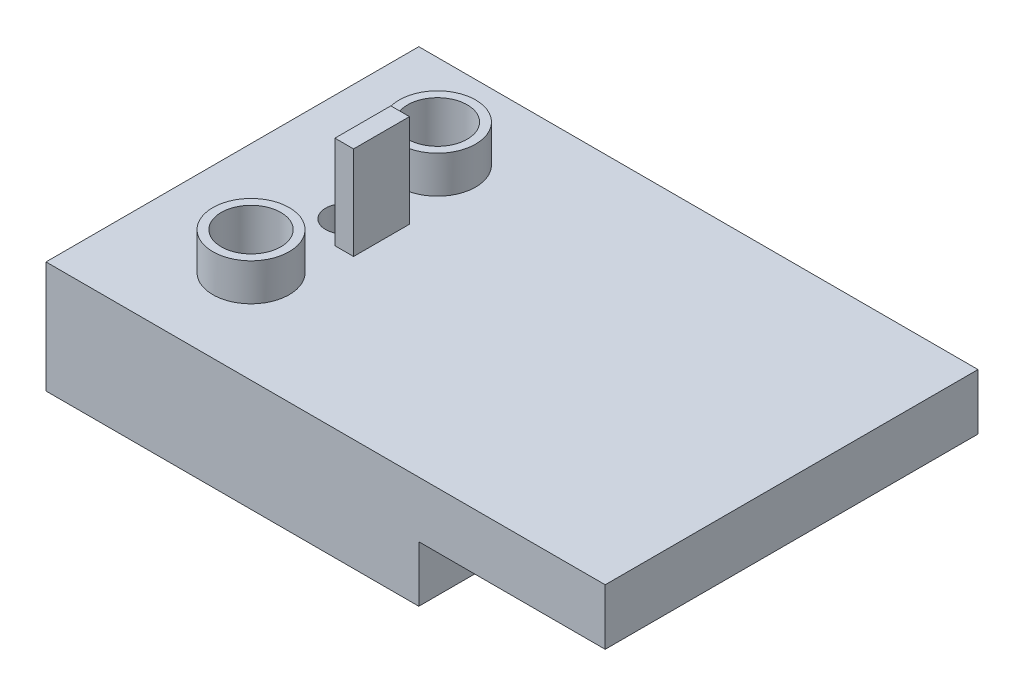
from build123d import *

# Parameters (mm, degrees)
CROQUIS1_W              = 30
CROQUIS1_H              = 20
SALIENTE_EXTRUIR1_DEPTH = 6
CROQUIS3_R              = 1.6
CORTAR_EXTRUIR2_DEPTH   = 40
SALIENTE_EXTRUIR2_START = 2
CROQUIS4_R              = 2.05
CROQUIS4_R_2            = 1.6
SALIENTE_EXTRUIR2_DEPTH = 2
CORTAR_EXTRUIR3_DEPTH   = 3
CROQUIS6_W              = 10
CROQUIS6_H              = 3
CORTAR_EXTRUIR4_DEPTH   = 24
CROQUIS7_R              = 1
CORTAR_EXTRUIR5_DEPTH   = 24
CROQUIS8_W              = 1
CROQUIS8_H              = 3
SALIENTE_EXTRUIR3_DEPTH = 5


with BuildPart() as part:
    # Croquis1 → Saliente-Extruir1 (new body)
    with BuildSketch(Plane(origin=(0, 0, 0), x_dir=(1, 0, 0), z_dir=(0, 1, 0))):
        with Locations((15, 10)):
            Rectangle(CROQUIS1_W, CROQUIS1_H)
    extrude(amount=SALIENTE_EXTRUIR1_DEPTH)

    # Croquis3 → Cortar-Extruir2 (cut)
    with BuildSketch(Plane(origin=(0, 6, 0), x_dir=(1, 0, 0), z_dir=(0, 1, 0))):
        with Locations(Location((6, 5, 0), (0, 0, 270))):
            Circle(CROQUIS3_R)
        with Locations(Location((6, 15, 0), (0, 0, 270))):
            Circle(CROQUIS3_R)
    extrude(amount=-CORTAR_EXTRUIR2_DEPTH, mode=Mode.SUBTRACT)

    # Croquis4 → Saliente-Extruir2 (add)
    # profile 1 of 2: a face of its own
    with BuildSketch(Plane(origin=(0, 6, 0), x_dir=(1, 0, 0), z_dir=(0, 1, 0)).offset(SALIENTE_EXTRUIR2_START)):
        with Locations(Location((6, 15, 0), (0, 0, 90))):
            Circle(CROQUIS4_R)
        with Locations(Location((6, 15, 0), (0, 0, 270))):
            Circle(CROQUIS4_R_2, mode=Mode.SUBTRACT)
    # profile 2 of 2: a face of its own
    with BuildSketch(Plane(origin=(0, 6, 0), x_dir=(1, 0, 0), z_dir=(0, 1, 0)).offset(SALIENTE_EXTRUIR2_START)):
        with Locations(Location((6, 5, 0), (0, 0, 90))):
            Circle(CROQUIS4_R)
        with Locations(Location((6, 5, 0), (0, 0, 270))):
            Circle(CROQUIS4_R_2, mode=Mode.SUBTRACT)
    extrude(amount=-SALIENTE_EXTRUIR2_DEPTH)

    # Croquis5 → Cortar-Extruir3 (cut)
    with BuildSketch(Plane.XZ):
        Polygon((9, -6.732050808), (9, -3.267949192), (6, -1.535898385), (3, -3.267949192), (3, -6.732050808), (6, -8.464101615), align=None)
        Polygon((9, -16.732050808), (9, -13.267949192), (6, -11.535898385), (3, -13.267949192), (3, -16.732050808), (6, -18.464101615), align=None)
    extrude(amount=-CORTAR_EXTRUIR3_DEPTH, mode=Mode.SUBTRACT)

    # Croquis6 → Cortar-Extruir4 (cut)
    with BuildSketch(Plane.XY):
        with Locations((25, 1.5)):
            Rectangle(CROQUIS6_W, CROQUIS6_H)
    extrude(amount=-CORTAR_EXTRUIR4_DEPTH, mode=Mode.SUBTRACT)

    # Croquis7 → Cortar-Extruir5 (cut)
    with BuildSketch(Plane(origin=(0, 6, 0), x_dir=(1, 0, 0), z_dir=(0, 1, 0))):
        with Locations(Location((6, 10, 0), (0, 0, 270))):
            Circle(CROQUIS7_R)
    extrude(amount=-CORTAR_EXTRUIR5_DEPTH, mode=Mode.SUBTRACT)

    # Croquis8 → Saliente-Extruir3 (add)
    with BuildSketch(Plane(origin=(0, 6, 0), x_dir=(1, 0, 0), z_dir=(0, 1, 0))):
        with Locations((7.5, 10)):
            Rectangle(CROQUIS8_W, CROQUIS8_H)
    extrude(amount=SALIENTE_EXTRUIR3_DEPTH)


solid = part.part
